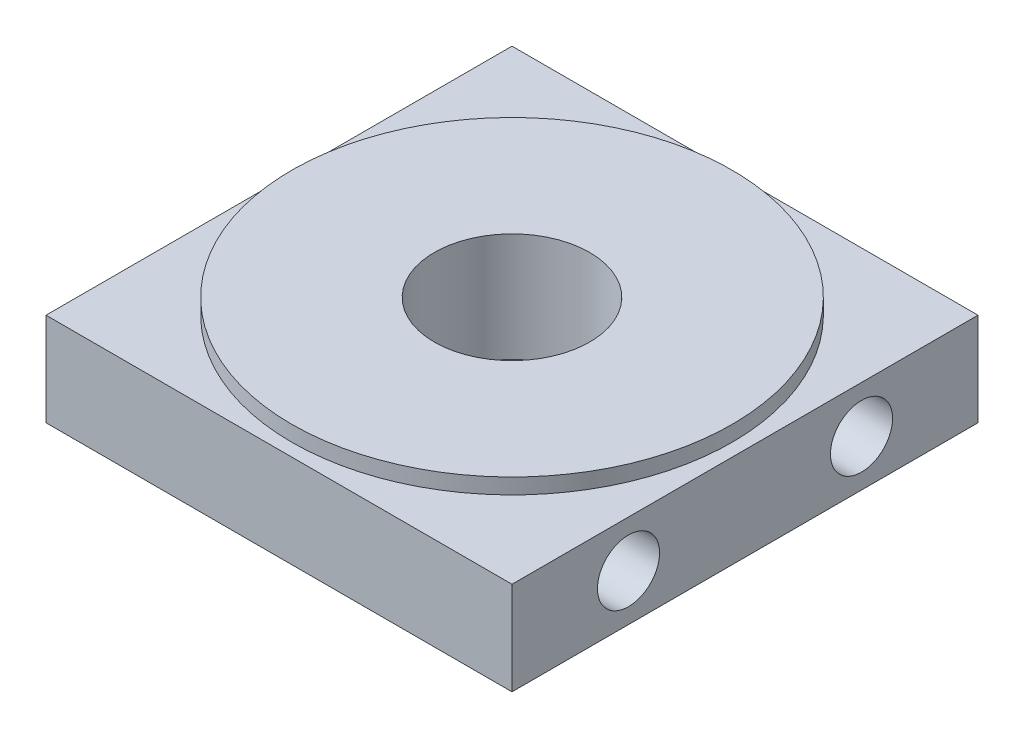
from build123d import *

# Parameters (mm, degrees)
SKETCH1_W           = 38.1
SKETCH1_H           = 38.1
BOSS_EXTRUDE1_DEPTH = 7.62
SKETCH2_R           = 18
SKETCH2_R_2         = 6.35
BOSS_EXTRUDE2_DEPTH = 1.27
SKETCH5_R           = 6.35
CUT_EXTRUDE1_DEPTH  = 31.365983763
SKETCH4_R           = 2.54
CUT_EXTRUDE2_DEPTH  = 7.62
CUT_EXTRUDE3_START  = -7.62
SKETCH6_R           = 2.54
CUT_EXTRUDE3_DEPTH  = 7.62


with BuildPart() as part:
    # Sketch1 → Boss-Extrude1 (new body)
    with BuildSketch(Plane(origin=(0, 0, 0), x_dir=(1, 0, 0), z_dir=(0, 1, 0))):
        with Locations((-0.926041667, 2.513541667)):
            Rectangle(SKETCH1_W, SKETCH1_H)
    extrude(amount=BOSS_EXTRUDE1_DEPTH)

    # Sketch2 → Boss-Extrude2 (add)
    with BuildSketch(Plane(origin=(0, 7.62, 0), x_dir=(1, 0, 0), z_dir=(0, 1, 0))):
        with Locations(Location((-0.926041667, 2.513541667, 0), (0, 0, 270))):
            Circle(SKETCH2_R)
        with Locations(Location((-0.926041667, 2.513541667, 0), (0, 0, 270))):
            Circle(SKETCH2_R_2, mode=Mode.SUBTRACT)
    extrude(amount=BOSS_EXTRUDE2_DEPTH)

    # Sketch5 → Cut-Extrude1 (cut, through all)
    with BuildSketch(Plane(origin=(0, 7.62, 0), x_dir=(1, 0, 0), z_dir=(0, 1, 0))):
        with Locations(Location((-0.926041667, 2.513541667, 0), (0, 0, 270))):
            Circle(SKETCH5_R)
    extrude(amount=-CUT_EXTRUDE1_DEPTH, mode=Mode.SUBTRACT)

    # Sketch4 → Cut-Extrude2 (cut)
    with BuildSketch(Plane.ZY.offset(19.976041667)):
        with Locations((-12.038541667, 3.81)):
            Circle(SKETCH4_R)
        with Locations((7.011458333, 3.81)):
            Circle(SKETCH4_R)
    extrude(amount=-CUT_EXTRUDE2_DEPTH, mode=Mode.SUBTRACT)

    # Sketch6 → Cut-Extrude3 (cut)
    with BuildSketch(Plane(origin=(18.123958333, 0, 0), x_dir=(0, 0, -1), z_dir=(1, 0, 0)).offset(CUT_EXTRUDE3_START)):
        with Locations(Location((-7.011458333, 3.81, 0), (0, 0, 180))):
            Circle(SKETCH6_R)
        with Locations(Location((12.038541667, 3.81, 0), (0, 0, 180))):
            Circle(SKETCH6_R)
    extrude(amount=CUT_EXTRUDE3_DEPTH, mode=Mode.SUBTRACT)


solid = part.part
